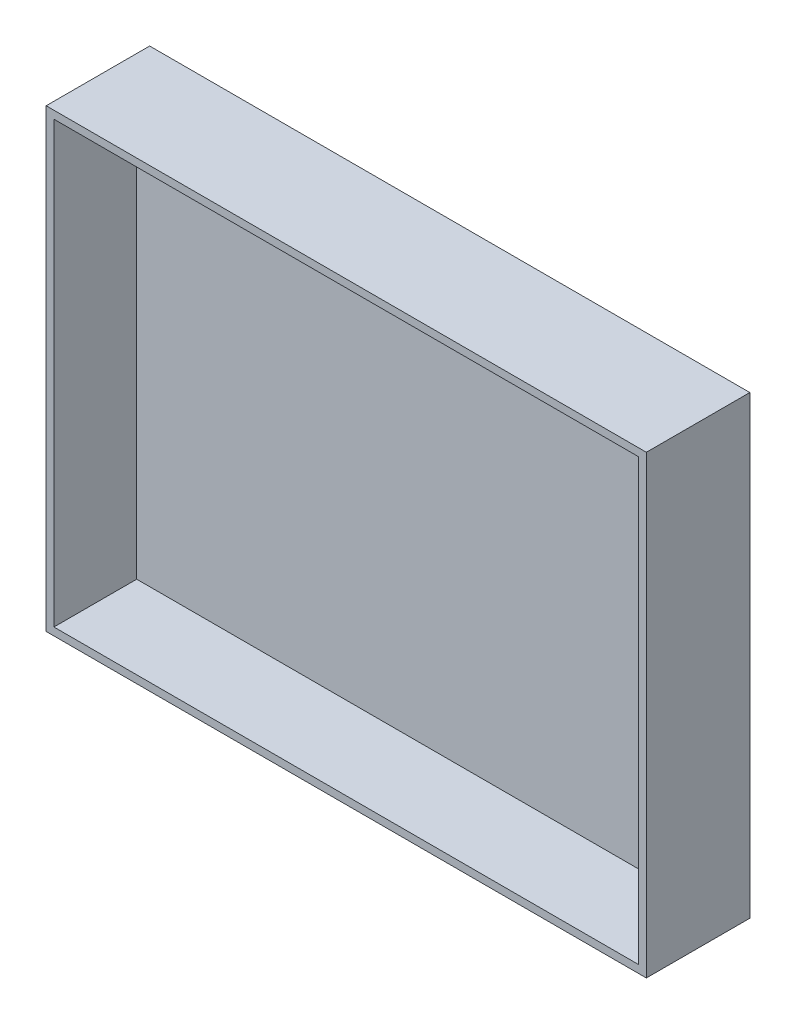
from build123d import *

# Parameters (mm, degrees)
SKETCH1_W           = 58
SKETCH1_H           = 44
SKETCH1_W_2         = 56.5
SKETCH1_H_2         = 42.5
BOSS_EXTRUDE1_DEPTH = 10
SKETCH2_W           = 58
SKETCH2_H           = 44
BOSS_EXTRUDE2_DEPTH = 2


with BuildPart() as part:
    # Sketch1 → Boss-Extrude1 (new body)
    with BuildSketch(Plane.XY):
        Rectangle(SKETCH1_W, SKETCH1_H)
        Rectangle(SKETCH1_W_2, SKETCH1_H_2, mode=Mode.SUBTRACT)
    extrude(amount=BOSS_EXTRUDE1_DEPTH)

    # Sketch2 → Boss-Extrude2 (add)
    with BuildSketch(Plane.XY):
        Rectangle(SKETCH2_W, SKETCH2_H)
    extrude(amount=BOSS_EXTRUDE2_DEPTH)


solid = part.part
